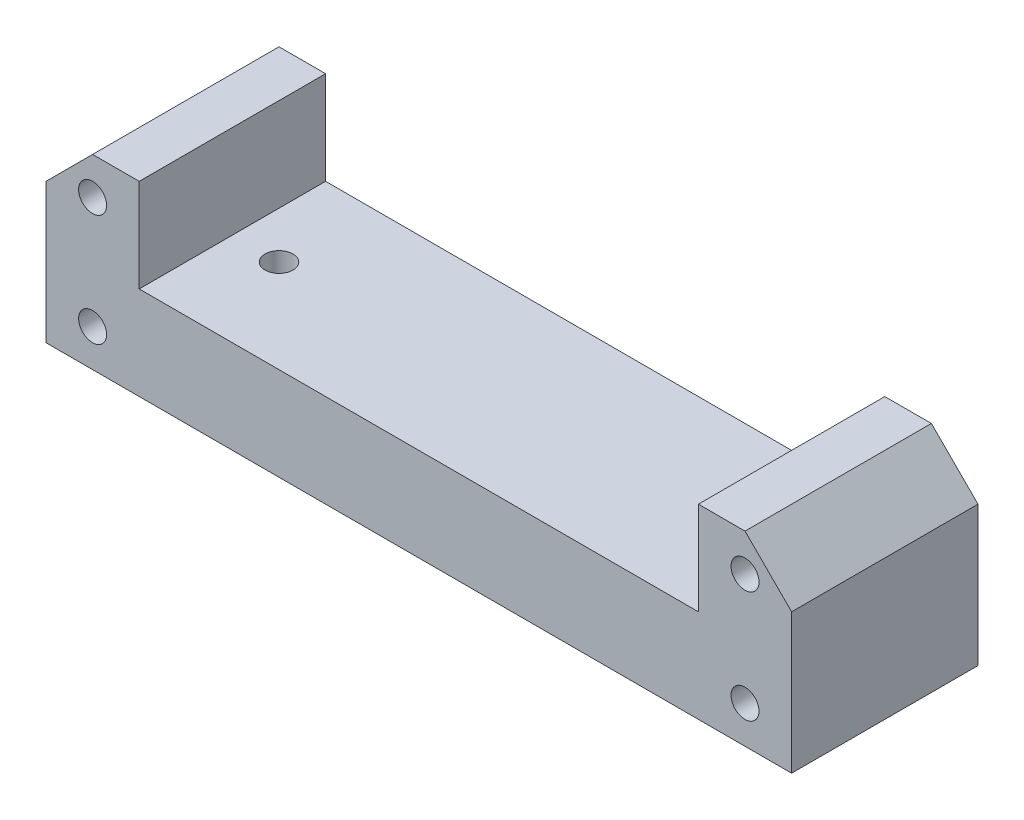
from build123d import *

# Parameters (mm, degrees)
SKETCH_1_W          = 80
SKETCH_1_H          = 20
EXTRUDE_1_DEPTH     = 20
SKETCH_2_W          = 60
SKETCH_2_H          = 20
CUT_EXTRUDE_1_DEPTH = 10
SKETCH_3_R          = 1.5
CUT_EXTRUDE_2_DEPTH = 43.426406871
CHAMFER_1_SIZE      = 5
SKETCH_4_R          = 1.5
CUT_EXTRUDE_3_DEPTH = 49.989794856


with BuildPart() as part:
    # 草图1 → 凸台-拉伸1 (new body)
    with BuildSketch(Plane(origin=(0, 0, 0), x_dir=(1, 0, 0), z_dir=(0, 1, 0))):
        Rectangle(SKETCH_1_W, SKETCH_1_H)
    extrude(amount=EXTRUDE_1_DEPTH)

    # 草图2 → 切除-拉伸1 (cut)
    with BuildSketch(Plane(origin=(0, 20, 0), x_dir=(1, 0, 0), z_dir=(0, 1, 0))):
        Rectangle(SKETCH_2_W, SKETCH_2_H)
    extrude(amount=-CUT_EXTRUDE_1_DEPTH, mode=Mode.SUBTRACT)

    # 草图3 → 切除-拉伸2 (cut, through all)
    with BuildSketch(Plane(origin=(0, 10, 0), x_dir=(1, 0, 0), z_dir=(0, 1, 0))):
        with Locations(Location((-25, 0, 0), (0, 0, 270))):
            Circle(SKETCH_3_R)
        with Locations(Location((25, 0, 0), (0, 0, 90))):
            Circle(SKETCH_3_R)
    extrude(amount=-CUT_EXTRUDE_2_DEPTH, mode=Mode.SUBTRACT)

    # 倒角1
    chamfer_1_edges = [part.edges().sort_by_distance(p)[0] for p in [
        (-40, 20, 0),
        (40, 20, 0),
    ]]
    chamfer(chamfer_1_edges, length=CHAMFER_1_SIZE)

    # 草图4 → 切除-拉伸3 (cut, through all)
    with BuildSketch(Plane.XY.offset(10)):
        with Locations((-35, 16)):
            Circle(SKETCH_4_R)
        with Locations(Location((-35, 4, 0), (0, 0, 180))):
            Circle(SKETCH_4_R)
        with Locations((35, 4)):
            Circle(SKETCH_4_R)
        with Locations(Location((35, 16, 0), (0, 0, 180))):
            Circle(SKETCH_4_R)
    extrude(amount=-CUT_EXTRUDE_3_DEPTH, mode=Mode.SUBTRACT)


solid = part.part
